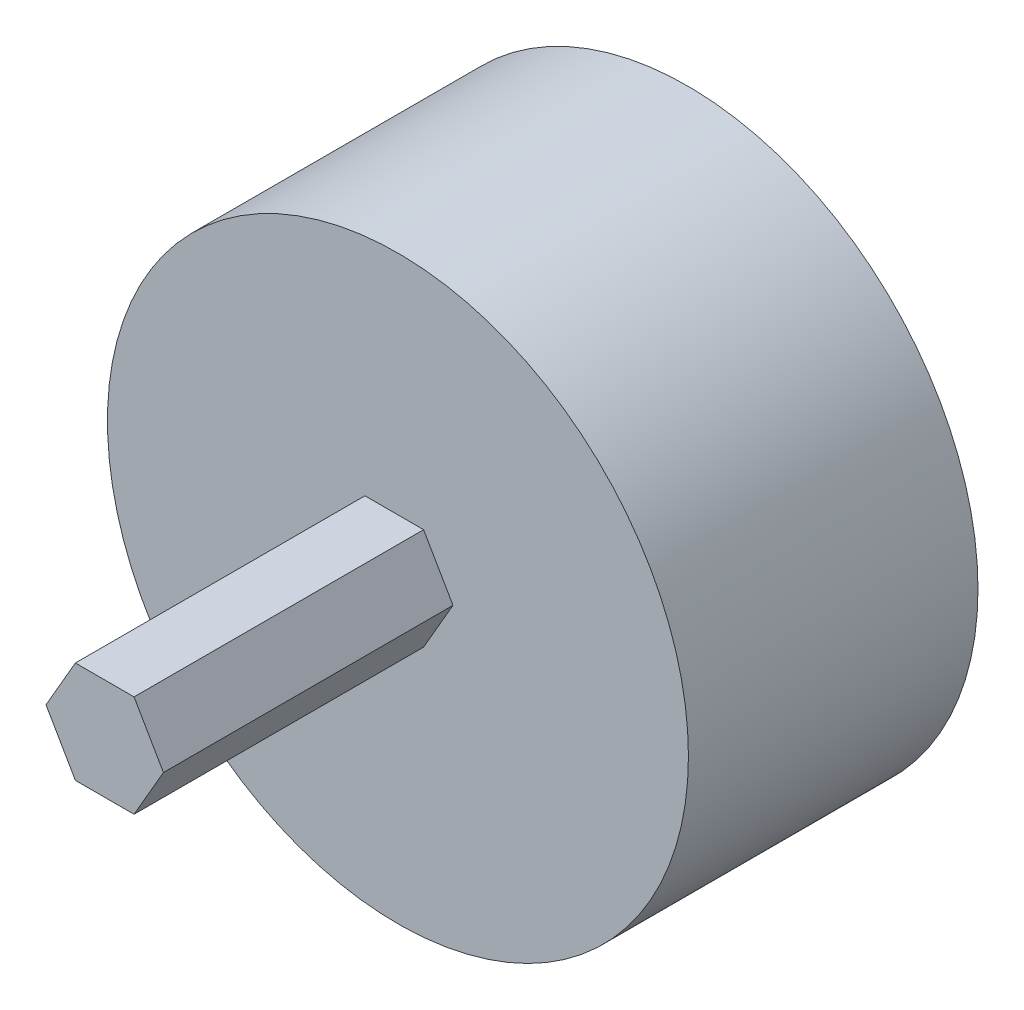
from build123d import *

# Parameters (mm, degrees)
SKETCH1_R           = 76.191937258
BOSS_EXTRUDE1_DEPTH = 75.946
BOSS_EXTRUDE2_DEPTH = 75.946


with BuildPart() as part:
    # Sketch1 → Boss-Extrude1 (new body)
    with BuildSketch(Plane.XY):
        with Locations((-25.384457056, 7.752300794)):
            Circle(SKETCH1_R)
    extrude(amount=BOSS_EXTRUDE1_DEPTH)

    # Sketch2 → Boss-Extrude2 (add)
    with BuildSketch(Plane.XY.offset(75.946)):
        Polygon((-10.949916627, 11.135298471), (-18.648882466, 24.470298471), (-34.046814146, 24.470298471), (-41.745779985, 11.135298471), (-34.046814146, -2.199701529), (-18.648882466, -2.199701529), align=None)
    extrude(amount=BOSS_EXTRUDE2_DEPTH)


solid = part.part
